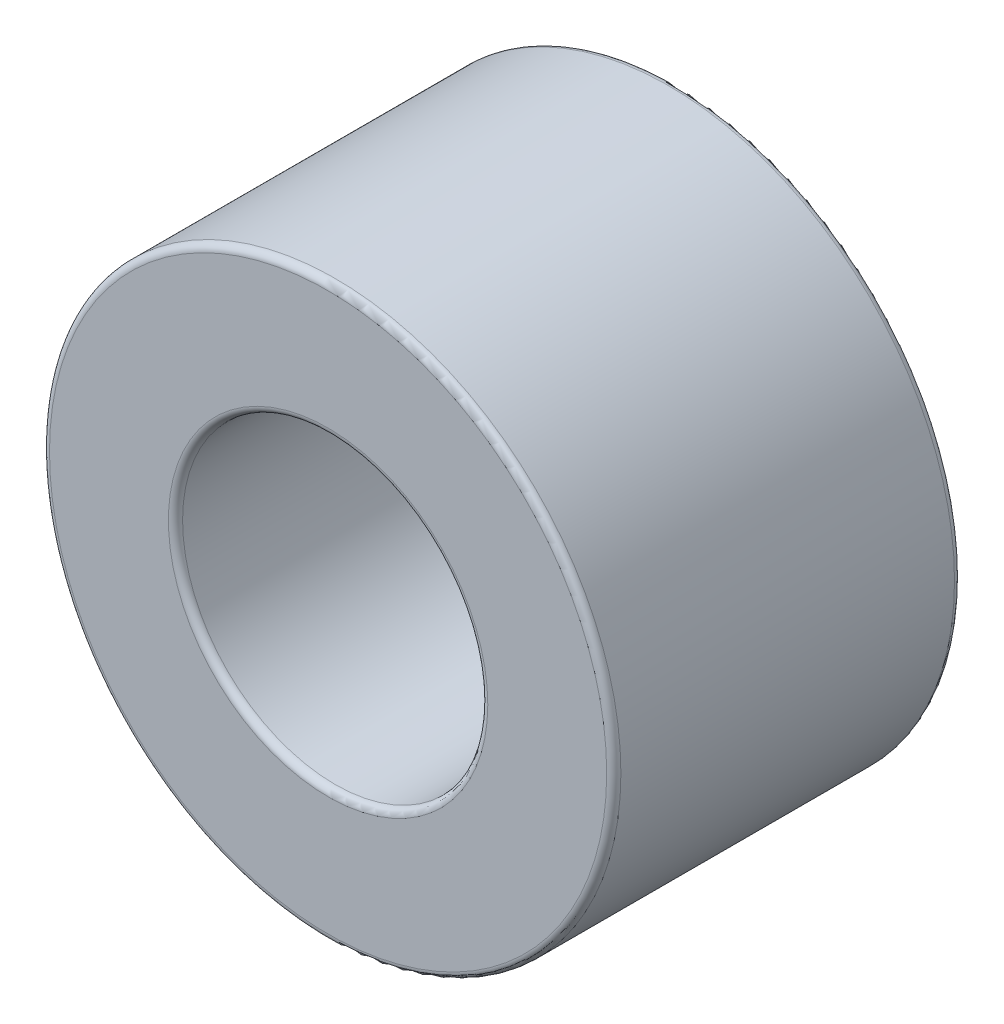
from build123d import *

# Parameters (mm, degrees)
SKETCH1_R           = 10.2235
SKETCH1_R_2         = 5.461
BOSS_EXTRUDE1_DEPTH = 12.446
FILLET2_R           = 0.254


with BuildPart() as part:
    # Sketch1 → Boss-Extrude1 (new body)
    with BuildSketch(Plane.XY):
        Circle(SKETCH1_R)
        Circle(SKETCH1_R_2, mode=Mode.SUBTRACT)
    extrude(amount=BOSS_EXTRUDE1_DEPTH)

    # Fillet2
    fillet2_edges = [part.edges().sort_by_distance(p)[0] for p in [
        (-10.2235, 0, 0),
        (-10.2235, 0, 12.446),
        (-5.461, 0, 0),
        (-5.461, 0, 12.446),
    ]]
    fillet(fillet2_edges, radius=FILLET2_R)


solid = part.part
